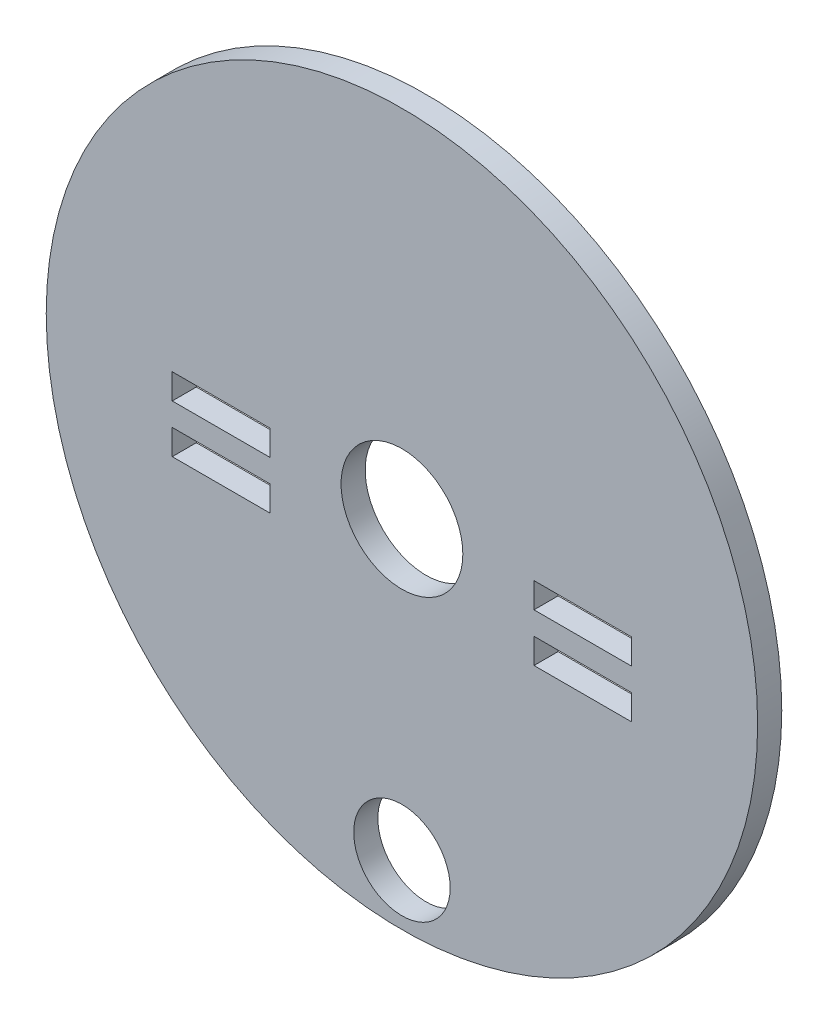
from build123d import *

# Parameters (mm, degrees)
SKETCH_1_R      = 29.5
SKETCH_1_R_2    = 5.05
SKETCH_1_R_3    = 4
SKETCH_1_W      = 8.1
SKETCH_1_H      = 2.1
EXTRUDE_1_DEPTH = 2


with BuildPart() as part:
    # 草图1 → 凸台-拉伸1 (new body)
    with BuildSketch(Plane.XY):
        with Locations((0, 4)):
            Circle(SKETCH_1_R)
        with Locations((0, 4)):
            Circle(SKETCH_1_R_2, mode=Mode.SUBTRACT)
        with Locations((0, -20.5)):
            Circle(SKETCH_1_R_3, mode=Mode.SUBTRACT)
        with Locations((-15, 4)):
            Rectangle(SKETCH_1_W, SKETCH_1_H, mode=Mode.SUBTRACT)
        with Locations((-15, 0)):
            Rectangle(SKETCH_1_W, SKETCH_1_H, mode=Mode.SUBTRACT)
        with Locations((15, 4)):
            Rectangle(SKETCH_1_W, SKETCH_1_H, mode=Mode.SUBTRACT)
        with Locations((15, 0)):
            Rectangle(SKETCH_1_W, SKETCH_1_H, mode=Mode.SUBTRACT)
    extrude(amount=EXTRUDE_1_DEPTH)


solid = part.part
